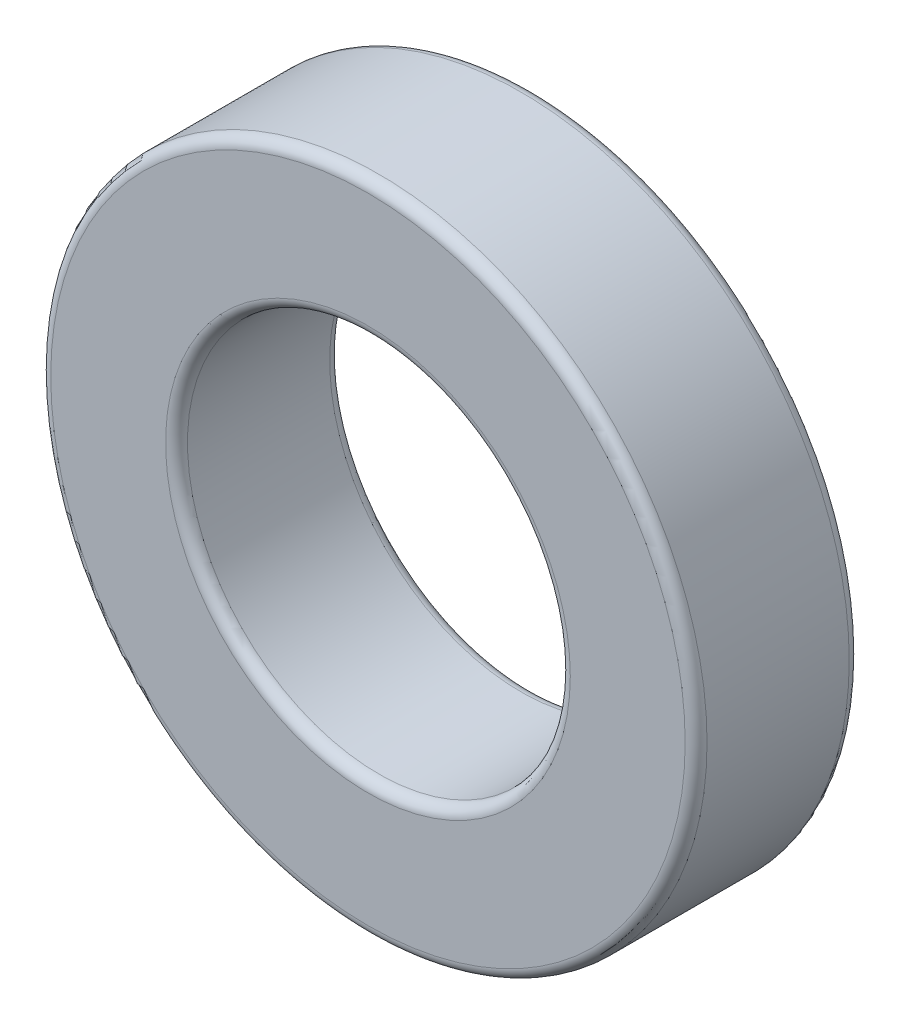
from build123d import *

# Parameters (mm, degrees)
SKETCH1_R           = 1.5
SKETCH1_R_2         = 0.875
BOSS_EXTRUDE1_DEPTH = 0.75
FILLET1_R           = 0.05


with BuildPart() as part:
    # Sketch1 → Boss-Extrude1 (new body)
    with BuildSketch(Plane.XY):
        Circle(SKETCH1_R)
        Circle(SKETCH1_R_2, mode=Mode.SUBTRACT)
    extrude(amount=BOSS_EXTRUDE1_DEPTH)

    # Fillet1
    fillet1_edges = [part.edges().sort_by_distance(p)[0] for p in [
        (-1.5, 0, 0),
        (-1.5, 0, 0.75),
        (-0.875, 0, 0),
        (-0.875, 0, 0.75),
    ]]
    fillet(fillet1_edges, radius=FILLET1_R)


solid = part.part
